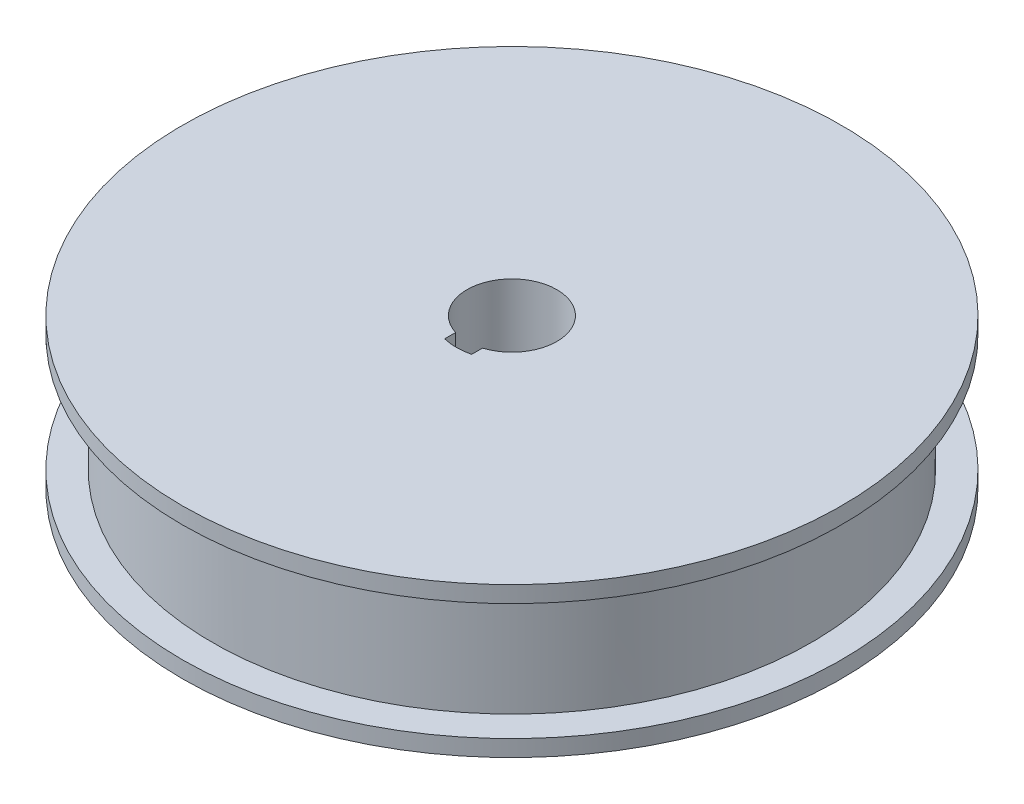
from build123d import *

# Parameters (mm, degrees)
SKETCH1_R           = 200
SKETCH1_R_2         = 30
BOSS_EXTRUDE1_DEPTH = 50
BOSS_EXTRUDE2_START = -11
SKETCH2_R           = 220
SKETCH2_R_2         = 30
BOSS_EXTRUDE2_DEPTH = 11
CUT_EXTRUDE1_DEPTH  = 327.802692767


with BuildPart() as part:
    # Sketch1 → Boss-Extrude1 (new, symmetric)
    with BuildSketch(Plane(origin=(0, 0, 0), x_dir=(1, 0, 0), z_dir=(0, 1, 0))):
        with Locations(Location((0, 0, 0), (0, 0, 270))):
            Circle(SKETCH1_R)
        with Locations(Location((0, 0, 0), (0, 0, 270))):
            Circle(SKETCH1_R_2, mode=Mode.SUBTRACT)
    extrude(amount=BOSS_EXTRUDE1_DEPTH, both=True)

    # Sketch2 → Boss-Extrude2 (add)
    with BuildSketch(Plane(origin=(0, 50, 0), x_dir=(1, 0, 0), z_dir=(0, 1, 0)).offset(BOSS_EXTRUDE2_START)):
        with Locations(Location((0, 0, 0), (0, 0, 270))):
            Circle(SKETCH2_R)
        with Locations(Location((0, 0, 0), (0, 0, 270))):
            Circle(SKETCH2_R_2, mode=Mode.SUBTRACT)
    boss_extrude2 = extrude(amount=BOSS_EXTRUDE2_DEPTH)

    # Mirror1: Boss-Extrude2 across plane
    add(boss_extrude2.mirror(Plane.ZX))

    # Sketch3 → Cut-Extrude1 (cut, through all)
    with BuildSketch(Plane.XZ.offset(50)):
        with BuildLine():
            Line((-9, 35.88871689), (-9, 22.85239639))
            Line((-9, 22.85239639), (9, 22.85239639))
            Line((9, 22.85239639), (9, 35.88871689))
            ThreePointArc((9, 35.88871689), (0, 37), (-9, 35.88871689))
        make_face()
    extrude(amount=-CUT_EXTRUDE1_DEPTH, mode=Mode.SUBTRACT)


solid = part.part
